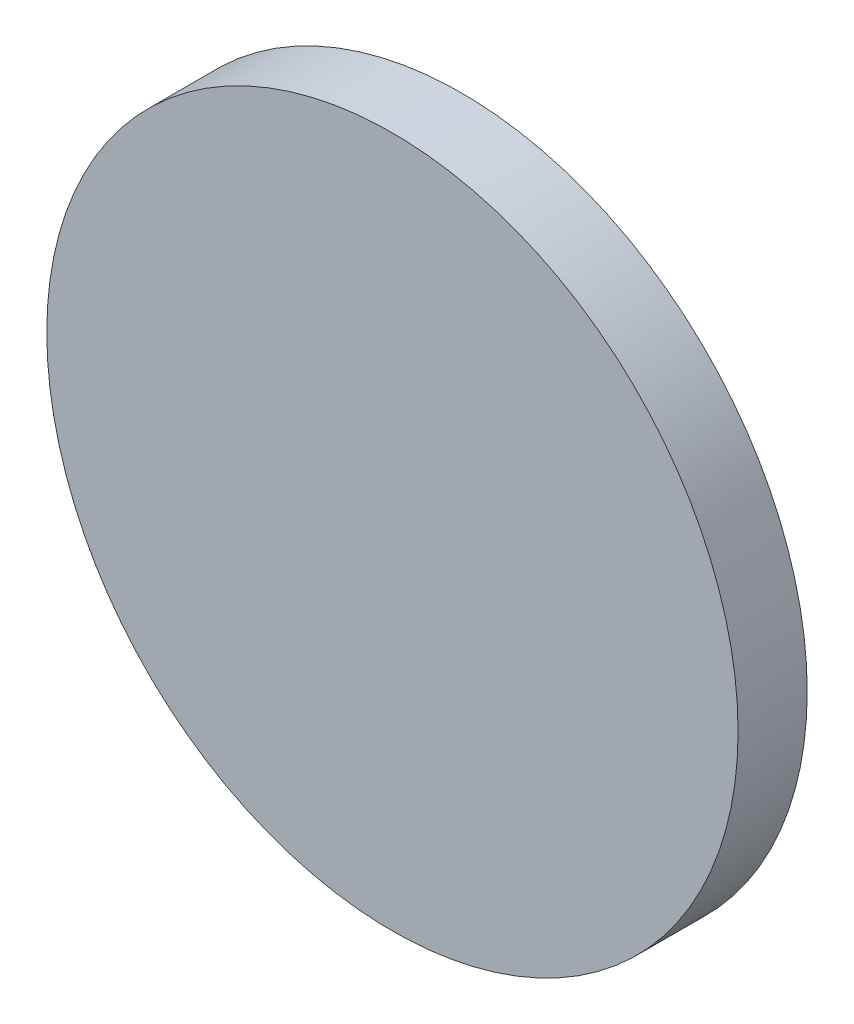
from build123d import *

# Parameters (mm, degrees)
SKETCH1_R          = 50
BASE_EXTRUDE_DEPTH = 10


with BuildPart() as part:
    # Sketch1 → Base-Extrude (new body)
    with BuildSketch(Plane.XY):
        with Locations((0, -179.95)):
            Circle(SKETCH1_R)
    extrude(amount=-BASE_EXTRUDE_DEPTH)


solid = part.part
